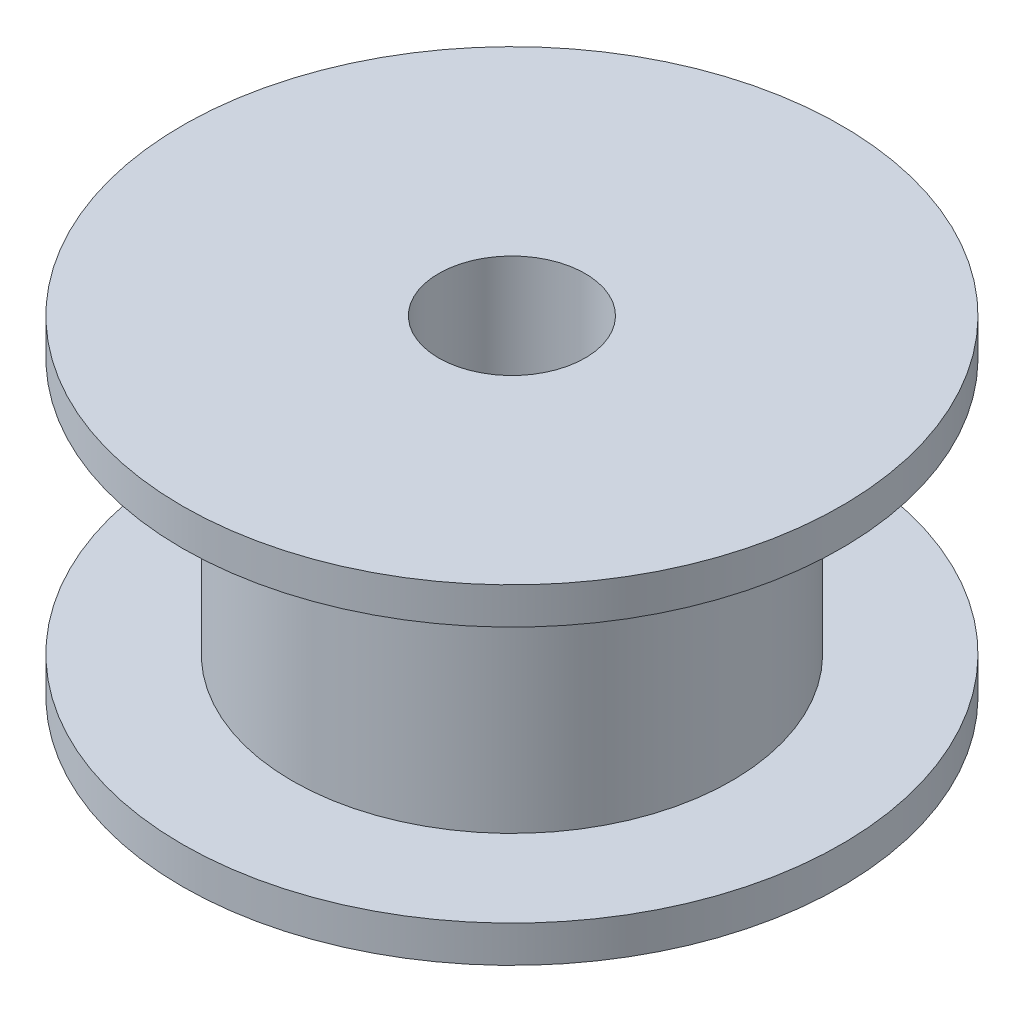
from build123d import *

# Parameters (mm, degrees)
SKETCH2_R           = 9
BOSS_EXTRUDE1_DEPTH = 1
SKETCH3_R           = 6
BOSS_EXTRUDE2_DEPTH = 7
SKETCH4_R           = 9
BOSS_EXTRUDE3_DEPTH = 1
SKETCH5_R           = 2
CUT_EXTRUDE1_DEPTH  = 16.588457268


with BuildPart() as part:
    # Sketch2 → Boss-Extrude1 (new body)
    with BuildSketch(Plane(origin=(0, 0, 0), x_dir=(1, 0, 0), z_dir=(0, 1, 0))):
        with Locations(Location((0, 0, 0), (0, 0, 270))):
            Circle(SKETCH2_R)
    extrude(amount=BOSS_EXTRUDE1_DEPTH)

    # Sketch3 → Boss-Extrude2 (add)
    with BuildSketch(Plane(origin=(0, 1, 0), x_dir=(1, 0, 0), z_dir=(0, 1, 0))):
        with Locations(Location((0, 0, 0), (0, 0, 270))):
            Circle(SKETCH3_R)
    extrude(amount=BOSS_EXTRUDE2_DEPTH)

    # Sketch4 → Boss-Extrude3 (add)
    with BuildSketch(Plane(origin=(0, 8, 0), x_dir=(1, 0, 0), z_dir=(0, 1, 0))):
        with Locations(Location((0, 0, 0), (0, 0, 270))):
            Circle(SKETCH4_R)
    extrude(amount=BOSS_EXTRUDE3_DEPTH)

    # Sketch5 → Cut-Extrude1 (cut, through all)
    with BuildSketch(Plane(origin=(0, 9, 0), x_dir=(1, 0, 0), z_dir=(0, 1, 0))):
        with Locations(Location((0, 0, 0), (0, 0, 270))):
            Circle(SKETCH5_R)
    extrude(amount=-CUT_EXTRUDE1_DEPTH, mode=Mode.SUBTRACT)


solid = part.part
